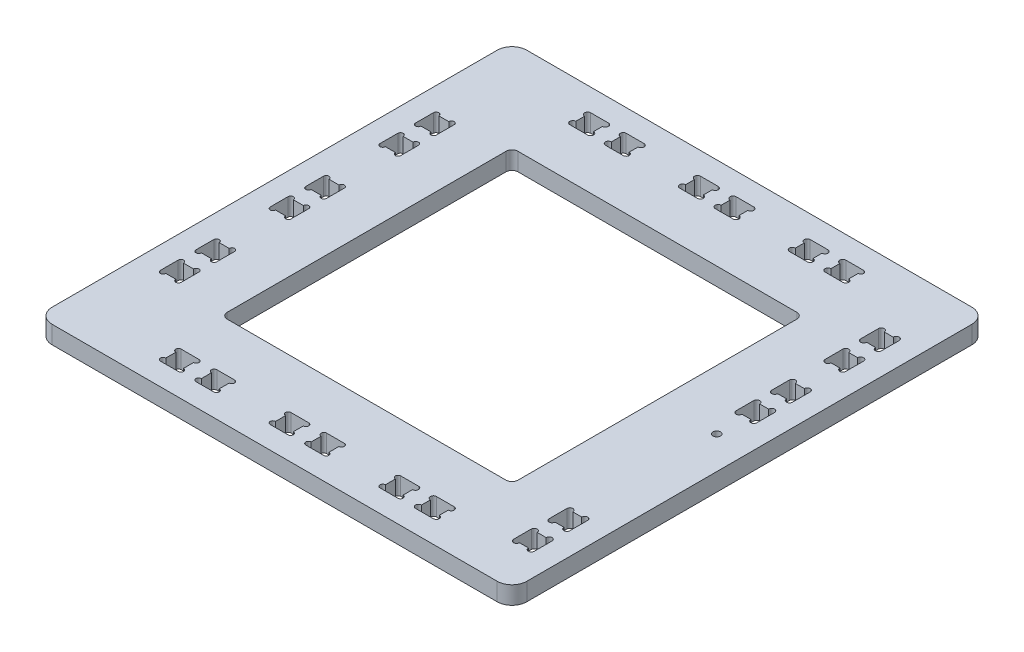
from build123d import *

# Parameters (mm, degrees)
SKETCH_1_W          = 160
SKETCH_1_H          = 160
SKETCH_1_W_2        = 98
SKETCH_1_H_2        = 98
EXTRUDE_1_DEPTH     = 6
SKETCH_2_W          = 6
SKETCH_2_H          = 7
SKETCH_2_W_2        = 7
SKETCH_2_H_2        = 6
CUT_EXTRUDE_1_DEPTH = 10
FILLET_1_R          = 5
FILLET_2_R          = 2
SKETCH_4_R          = 1.25
CUT_EXTRUDE_3_DEPTH = 114.296072306
SKETCH_5_R          = 0.907688999
SKETCH_5_R_2        = 1
CUT_EXTRUDE_4_DEPTH = 10


with BuildPart() as part:
    # 스케치1 → 보스-돌출1 (new body)
    with BuildSketch(Plane(origin=(0, 0, 0), x_dir=(1, 0, 0), z_dir=(0, 1, 0))):
        Rectangle(SKETCH_1_W, SKETCH_1_H)
        Rectangle(SKETCH_1_W_2, SKETCH_1_H_2, mode=Mode.SUBTRACT)
    extrude(amount=EXTRUDE_1_DEPTH)

    # 스케치2 → 컷-돌출1 (cut)
    with BuildSketch(Plane.XZ):
        with Locations((-43, 69)):
            Rectangle(SKETCH_2_W, SKETCH_2_H)
        with Locations((-31, 69)):
            Rectangle(SKETCH_2_W, SKETCH_2_H)
        with Locations((-6, 69)):
            Rectangle(SKETCH_2_W, SKETCH_2_H)
        with Locations((6, 69)):
            Rectangle(SKETCH_2_W, SKETCH_2_H)
        with Locations((31, 69)):
            Rectangle(SKETCH_2_W, SKETCH_2_H)
        with Locations((43, 69)):
            Rectangle(SKETCH_2_W, SKETCH_2_H)
        with Locations((69, 62)):
            Rectangle(SKETCH_2_W_2, SKETCH_2_H_2)
        with Locations((69, 50)):
            Rectangle(SKETCH_2_W_2, SKETCH_2_H_2)
        with Locations((69, -13)):
            Rectangle(SKETCH_2_W_2, SKETCH_2_H_2)
        with Locations((69, -25)):
            Rectangle(SKETCH_2_W_2, SKETCH_2_H_2)
        with Locations((69, -43)):
            Rectangle(SKETCH_2_W_2, SKETCH_2_H_2)
        with Locations((69, -55)):
            Rectangle(SKETCH_2_W_2, SKETCH_2_H_2)
        with Locations((6, -69)):
            Rectangle(SKETCH_2_W, SKETCH_2_H)
        with Locations((-6, -69)):
            Rectangle(SKETCH_2_W, SKETCH_2_H)
        with Locations((-31, -69)):
            Rectangle(SKETCH_2_W, SKETCH_2_H)
        with Locations((-43, -69)):
            Rectangle(SKETCH_2_W, SKETCH_2_H)
        with Locations((-69, -43)):
            Rectangle(SKETCH_2_W_2, SKETCH_2_H_2)
        with Locations((-69, -31)):
            Rectangle(SKETCH_2_W_2, SKETCH_2_H_2)
        with Locations((-69, -6)):
            Rectangle(SKETCH_2_W_2, SKETCH_2_H_2)
        with Locations((-69, 6)):
            Rectangle(SKETCH_2_W_2, SKETCH_2_H_2)
        with Locations((-69, 31)):
            Rectangle(SKETCH_2_W_2, SKETCH_2_H_2)
        with Locations((-69, 43)):
            Rectangle(SKETCH_2_W_2, SKETCH_2_H_2)
        with Locations((31, -69)):
            Rectangle(SKETCH_2_W, SKETCH_2_H)
        with Locations((43, -69)):
            Rectangle(SKETCH_2_W, SKETCH_2_H)
    extrude(amount=-CUT_EXTRUDE_1_DEPTH, mode=Mode.SUBTRACT)

    # 필렛1
    fillet_1_edges = [part.edges().sort_by_distance(p)[0] for p in [
        (80, 3, 80),
        (-80, 3, 80),
        (-80, 3, -80),
        (80, 3, -80),
    ]]
    fillet(fillet_1_edges, radius=FILLET_1_R)

    # 필렛2
    fillet_2_edges = [part.edges().sort_by_distance(p)[0] for p in [
        (49, 3, 49),
        (49, 3, -49),
        (-49, 3, -49),
        (-49, 3, 49),
    ]]
    fillet(fillet_2_edges, radius=FILLET_2_R)

    # 스케치4 → 컷-돌출3 (cut, through all)
    with BuildSketch(Plane(origin=(0, 6, 0), x_dir=(1, 0, 0), z_dir=(0, 1, 0))):
        with Locations(Location((69, 0, 0), (0, 0, 270))):
            Circle(SKETCH_4_R)
    extrude(amount=-CUT_EXTRUDE_3_DEPTH, mode=Mode.SUBTRACT)

    # 스케치5 → 컷-돌출4 (cut)
    with BuildSketch(Plane(origin=(0, 6, 0), x_dir=(1, 0, 0), z_dir=(0, 1, 0))):
        with Locations((28, -66.407688999)):
            Circle(SKETCH_5_R)
        with Locations((40, 71.5)):
            Circle(SKETCH_5_R_2)
        with Locations((40, 66.5)):
            Circle(SKETCH_5_R_2)
        with Locations((46, 66.5)):
            Circle(SKETCH_5_R_2)
        with Locations((34, 71.5)):
            Circle(SKETCH_5_R_2)
        with Locations((28, 71.5)):
            Circle(SKETCH_5_R_2)
        with Locations((28, 66.5)):
            Circle(SKETCH_5_R_2)
        with Locations((34, 66.5)):
            Circle(SKETCH_5_R_2)
        with Locations((9, 71.5)):
            Circle(SKETCH_5_R_2)
        with Locations((3, 71.5)):
            Circle(SKETCH_5_R_2)
        with Locations((3, 66.5)):
            Circle(SKETCH_5_R_2)
        with Locations((9, 66.5)):
            Circle(SKETCH_5_R_2)
        with Locations((-3, 71.5)):
            Circle(SKETCH_5_R_2)
        with Locations((-3, 66.5)):
            Circle(SKETCH_5_R_2)
        with Locations((-9, 66.5)):
            Circle(SKETCH_5_R_2)
        with Locations((-9, 71.5)):
            Circle(SKETCH_5_R_2)
        with Locations((-40, 71.5)):
            Circle(SKETCH_5_R_2)
        with Locations((-40, 66.5)):
            Circle(SKETCH_5_R_2)
        with Locations((-46, 66.5)):
            Circle(SKETCH_5_R_2)
        with Locations((-46, 71.5)):
            Circle(SKETCH_5_R_2)
        with Locations((-34, 71.5)):
            Circle(SKETCH_5_R_2)
        with Locations((-28, 71.5)):
            Circle(SKETCH_5_R_2)
        with Locations((-28, 66.5)):
            Circle(SKETCH_5_R_2)
        with Locations((-34, 66.5)):
            Circle(SKETCH_5_R_2)
        with Locations((71.5, 58)):
            Circle(SKETCH_5_R_2)
        with Locations((66.5, 58)):
            Circle(SKETCH_5_R_2)
        with Locations((66.5, 52)):
            Circle(SKETCH_5_R_2)
        with Locations((71.5, 52)):
            Circle(SKETCH_5_R_2)
        with Locations((66.5, 40)):
            Circle(SKETCH_5_R_2)
        with Locations((66.5, 46)):
            Circle(SKETCH_5_R_2)
        with Locations((71.5, 46)):
            Circle(SKETCH_5_R_2)
        with Locations((71.5, 40)):
            Circle(SKETCH_5_R_2)
        with Locations((66.5, 28)):
            Circle(SKETCH_5_R_2)
        with Locations((71.5, 28)):
            Circle(SKETCH_5_R_2)
        with Locations((71.5, 22)):
            Circle(SKETCH_5_R_2)
        with Locations((66.5, 22)):
            Circle(SKETCH_5_R_2)
        with Locations((66.5, 16)):
            Circle(SKETCH_5_R_2)
        with Locations((71.5, 16)):
            Circle(SKETCH_5_R_2)
        with Locations((71.5, 10)):
            Circle(SKETCH_5_R_2)
        with Locations((66.5, 10)):
            Circle(SKETCH_5_R_2)
        with Locations((66.5, -47)):
            Circle(SKETCH_5_R_2)
        with Locations((66.5, -53)):
            Circle(SKETCH_5_R_2)
        with Locations((71.5, -53)):
            Circle(SKETCH_5_R_2)
        with Locations((71.5, -47)):
            Circle(SKETCH_5_R_2)
        with Locations((71.5, -59)):
            Circle(SKETCH_5_R_2)
        with Locations((66.5, -59)):
            Circle(SKETCH_5_R_2)
        with Locations((66.5, -65)):
            Circle(SKETCH_5_R_2)
        with Locations((71.5, -65)):
            Circle(SKETCH_5_R_2)
        with Locations((46, -66.5)):
            Circle(SKETCH_5_R_2)
        with Locations((40, -66.5)):
            Circle(SKETCH_5_R_2)
        with Locations((40, -71.5)):
            Circle(SKETCH_5_R_2)
        with Locations((46, -71.5)):
            Circle(SKETCH_5_R_2)
        with Locations((34, -66.5)):
            Circle(SKETCH_5_R_2)
        with Locations((46, 71.592311001)):
            Circle(SKETCH_5_R)
        with Locations((28, -71.592311001)):
            Circle(SKETCH_5_R)
        with Locations((34, -71.592311001)):
            Circle(SKETCH_5_R)
        with Locations((3, -66.407688999)):
            Circle(SKETCH_5_R)
        with Locations((9, -66.407688999)):
            Circle(SKETCH_5_R)
        with Locations((9, -71.592311001)):
            Circle(SKETCH_5_R)
        with Locations((3, -71.592311001)):
            Circle(SKETCH_5_R)
        with Locations((-3, -66.407688999)):
            Circle(SKETCH_5_R)
        with Locations((-3, -71.592311001)):
            Circle(SKETCH_5_R)
        with Locations((-9, -66.407688999)):
            Circle(SKETCH_5_R)
        with Locations((-9, -71.592311001)):
            Circle(SKETCH_5_R)
        with Locations((-34, -66.407688999)):
            Circle(SKETCH_5_R)
        with Locations((-28, -66.407688999)):
            Circle(SKETCH_5_R)
        with Locations((-28, -71.592311001)):
            Circle(SKETCH_5_R)
        with Locations((-34, -71.592311001)):
            Circle(SKETCH_5_R)
        with Locations((-40, -66.407688999)):
            Circle(SKETCH_5_R)
        with Locations((-46, -66.407688999)):
            Circle(SKETCH_5_R)
        with Locations((-46, -71.592311001)):
            Circle(SKETCH_5_R)
        with Locations((-40, -71.592311001)):
            Circle(SKETCH_5_R)
        with Locations((-66.407688999, 46)):
            Circle(SKETCH_5_R)
        with Locations((-71.592311001, 46)):
            Circle(SKETCH_5_R)
        with Locations((-71.592311001, 40)):
            Circle(SKETCH_5_R)
        with Locations((-66.407688999, 40)):
            Circle(SKETCH_5_R)
        with Locations((-66.407688999, 34)):
            Circle(SKETCH_5_R)
        with Locations((-71.592311001, 34)):
            Circle(SKETCH_5_R)
        with Locations((-66.407688999, 28)):
            Circle(SKETCH_5_R)
        with Locations((-71.592311001, 28)):
            Circle(SKETCH_5_R)
        with Locations((-66.407688999, 9)):
            Circle(SKETCH_5_R)
        with Locations((-71.592311001, 9)):
            Circle(SKETCH_5_R)
        with Locations((-71.592311001, 3)):
            Circle(SKETCH_5_R)
        with Locations((-66.407688999, 3)):
            Circle(SKETCH_5_R)
        with Locations((-66.407688999, -3)):
            Circle(SKETCH_5_R)
        with Locations((-71.592311001, -3)):
            Circle(SKETCH_5_R)
        with Locations((-66.407688999, -9)):
            Circle(SKETCH_5_R)
        with Locations((-71.592311001, -9)):
            Circle(SKETCH_5_R)
        with Locations((-66.407688999, -28)):
            Circle(SKETCH_5_R)
        with Locations((-71.592311001, -28)):
            Circle(SKETCH_5_R)
        with Locations((-71.592311001, -34)):
            Circle(SKETCH_5_R)
        with Locations((-66.407688999, -34)):
            Circle(SKETCH_5_R)
        with Locations((-66.407688999, -40)):
            Circle(SKETCH_5_R)
        with Locations((-71.592311001, -40)):
            Circle(SKETCH_5_R)
        with Locations((-71.592311001, -46)):
            Circle(SKETCH_5_R)
        with Locations((-66.407688999, -46)):
            Circle(SKETCH_5_R)
    extrude(amount=-CUT_EXTRUDE_4_DEPTH, mode=Mode.SUBTRACT)


solid = part.part
